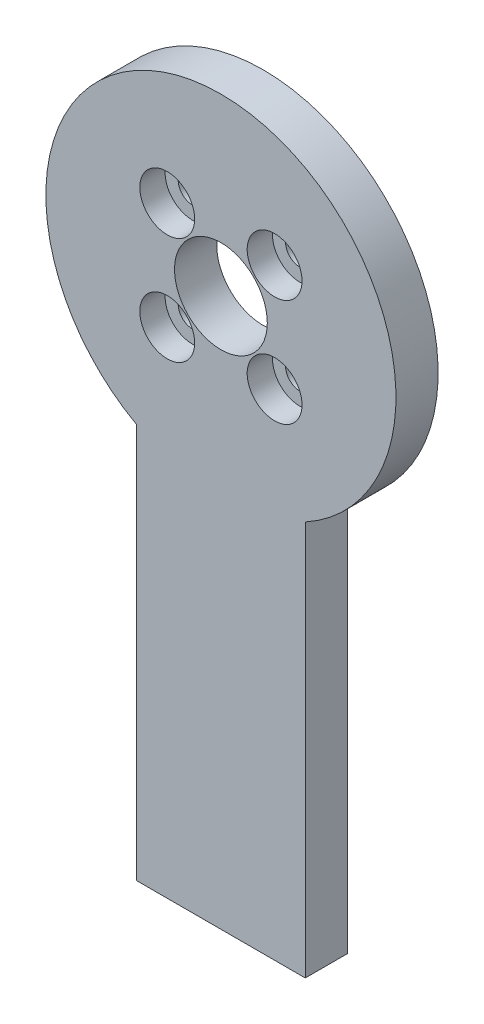
from build123d import *

# Parameters (mm, degrees)
SKETCH_1_R                  = 20.75
EXTRUDE_1_DEPTH             = 5
HOLE_WIZARD_M31_D           = 3.4
HOLE_WIZARD_M31_CBORE_D     = 6.5
HOLE_WIZARD_M31_CBORE_DEPTH = 3
SKETCH_5_R                  = 5.5
CUT_EXTRUDE_1_DEPTH         = 30.767851787
SKETCH_6_W                  = 20
SKETCH_6_H                  = 50
EXTRUDE_2_DEPTH             = 5


with BuildPart() as part:
    # Эскиз1 → Бобышка-Вытянуть1 (new body)
    with BuildSketch(Plane.XY):
        Circle(SKETCH_1_R)
    extrude(amount=EXTRUDE_1_DEPTH)

    # Цековка для винта с внутренним шестигранником M31 (through all)
    with Locations(Plane.XY.offset(5)):
        with Locations((-6.363961031, 6.363961031), (6.363961031, 6.363961031), (6.363961031, -6.363961031), (-6.363961031, -6.363961031)):
            CounterBoreHole(HOLE_WIZARD_M31_D / 2, HOLE_WIZARD_M31_CBORE_D / 2, HOLE_WIZARD_M31_CBORE_DEPTH)

    # Эскиз5 → Вырез-Вытянуть1 (cut, through all)
    with BuildSketch(Plane.XY.offset(5)):
        Circle(SKETCH_5_R)
    extrude(amount=-CUT_EXTRUDE_1_DEPTH, mode=Mode.SUBTRACT)

    # Эскиз6 → Бобышка-Вытянуть2 (add)
    with BuildSketch(Plane.XY.offset(5)):
        with Locations((0, -40)):
            Rectangle(SKETCH_6_W, SKETCH_6_H)
    extrude(amount=-EXTRUDE_2_DEPTH)


solid = part.part
